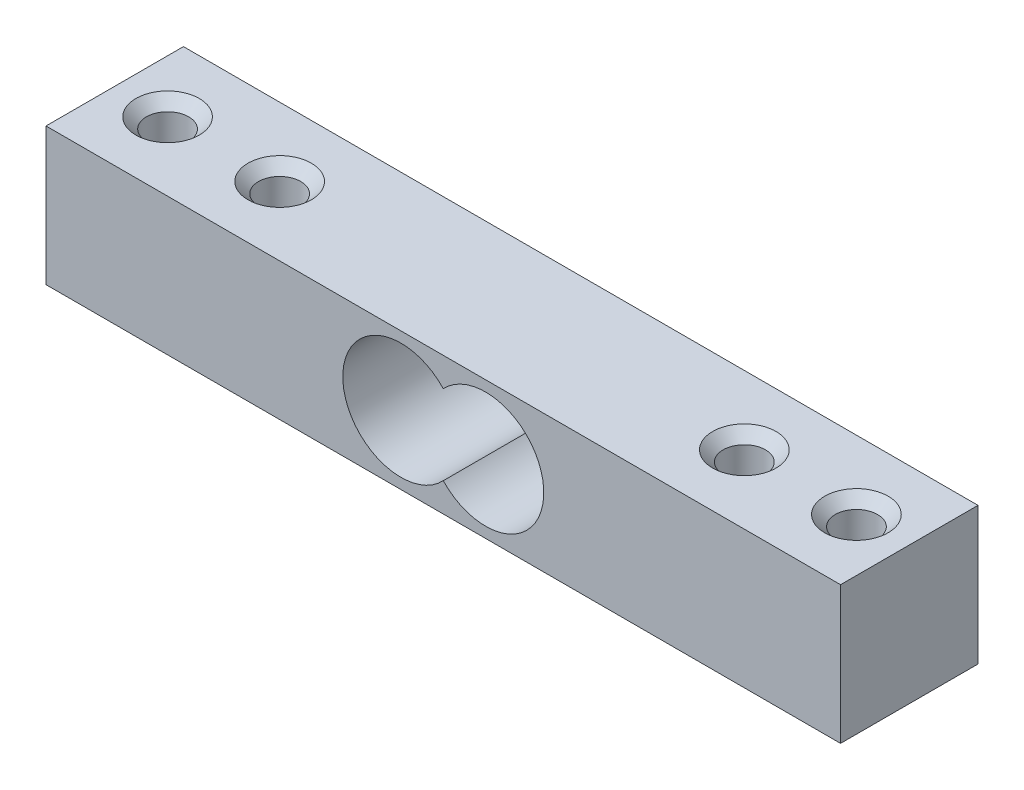
from build123d import *

# Parameters (mm, degrees)
SKETCH1_W           = 75.15
SKETCH1_H           = 13
SKETCH1_R           = 2
BOSS_EXTRUDE1_DEPTH = 13
CHAMFER1_SIZE       = 1
CHAMFER2_SIZE       = 1
CUT_EXTRUDE1_DEPTH  = 13


with BuildPart() as part:
    # Sketch1 → Boss-Extrude1 (new body)
    with BuildSketch(Plane(origin=(0, 0, 0), x_dir=(1, 0, 0), z_dir=(0, 1, 0))):
        with Locations((-2.595641447, 7.241611842)):
            Rectangle(SKETCH1_W, SKETCH1_H)
        with Locations(Location((29.979358553, 7.241611842, 0), (0, 0, 90))):
            Circle(SKETCH1_R, mode=Mode.SUBTRACT)
        with Locations(Location((19.379358553, 7.241611842, 0), (0, 0, 90))):
            Circle(SKETCH1_R, mode=Mode.SUBTRACT)
        with Locations(Location((-35.170641447, 7.241611842, 0), (0, 0, 90))):
            Circle(SKETCH1_R, mode=Mode.SUBTRACT)
        with Locations(Location((-24.570641447, 7.241611842, 0), (0, 0, 90))):
            Circle(SKETCH1_R, mode=Mode.SUBTRACT)
    extrude(amount=BOSS_EXTRUDE1_DEPTH)

    # Chamfer1
    chamfer1_edges = [part.edges().sort_by_distance(p)[0] for p in [
        (19.379358553, 0, -5.241611842),
    ]]
    chamfer(chamfer1_edges, length=CHAMFER1_SIZE)

    # Chamfer2
    chamfer2_edges = [part.edges().sort_by_distance(p)[0] for p in [
        (29.979358553, 0, -5.241611842),
        (29.979358553, 13, -5.241611842),
        (19.379358553, 13, -5.241611842),
        (-35.170641447, 0, -5.241611842),
        (-35.170641447, 13, -5.241611842),
        (-24.570641447, 0, -5.241611842),
        (-24.570641447, 13, -5.241611842),
    ]]
    chamfer(chamfer2_edges, length=CHAMFER2_SIZE)

    # Sketch2 → Cut-Extrude1 (cut)
    with BuildSketch(Plane.XY.offset(-0.741611842)):
        with BuildLine():
            ThreePointArc((-2.595641447, 10.269612049), (-1.48803448, 8.52762176), (-1.100641447, 6.5))
            Line((-1.100641447, 6.5), (6.909358553, 6.5))
            ThreePointArc((6.909358553, 6.5), (3.436980312, 11.612606967), (-2.595641447, 10.269612049))
        make_face()
        with BuildLine():
            ThreePointArc((-2.595641447, 2.730387951), (-1.48803448, 4.47237824), (-1.100641447, 6.5))
            Line((-1.100641447, 6.5), (-4.090641447, 6.5))
            ThreePointArc((-4.090641447, 6.5), (-3.703248414, 4.47237824), (-2.595641447, 2.730387951))
        make_face()
        with BuildLine():
            Line((-4.090641447, 6.5), (-1.100641447, 6.5))
            ThreePointArc((-1.100641447, 6.5), (-1.48803448, 8.52762176), (-2.595641447, 10.269612049))
            ThreePointArc((-2.595641447, 10.269612049), (-3.703248414, 8.52762176), (-4.090641447, 6.5))
        make_face()
        with BuildLine():
            Line((6.909358553, 6.5), (-1.100641447, 6.5))
            ThreePointArc((-1.100641447, 6.5), (-1.48803448, 4.47237824), (-2.595641447, 2.730387951))
            ThreePointArc((-2.595641447, 2.730387951), (3.436980312, 1.387393033), (6.909358553, 6.5))
        make_face()
        with BuildLine():
            ThreePointArc((-2.595641447, 2.730387951), (-3.703248414, 4.47237824), (-4.090641447, 6.5))
            Line((-4.090641447, 6.5), (-12.100641447, 6.5))
            ThreePointArc((-12.100641447, 6.5), (-8.628263207, 1.387393033), (-2.595641447, 2.730387951))
        make_face()
        with BuildLine():
            Line((-12.100641447, 6.5), (-4.090641447, 6.5))
            ThreePointArc((-4.090641447, 6.5), (-3.703248414, 8.52762176), (-2.595641447, 10.269612049))
            ThreePointArc((-2.595641447, 10.269612049), (-8.628263207, 11.612606967), (-12.100641447, 6.5))
        make_face()
    extrude(amount=-CUT_EXTRUDE1_DEPTH, mode=Mode.SUBTRACT)


solid = part.part
